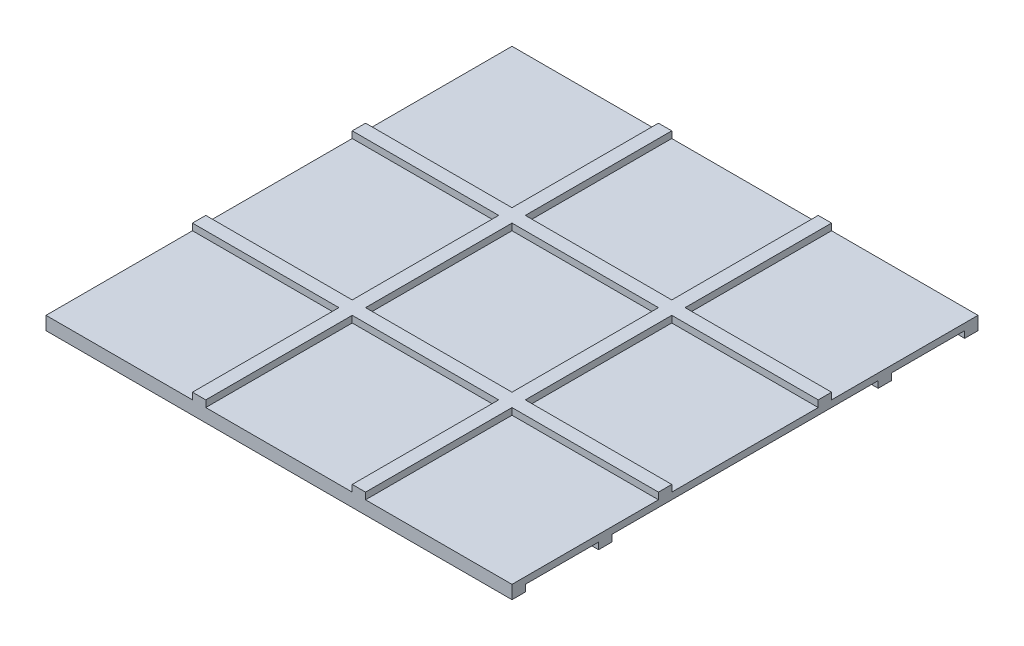
from build123d import *

# Parameters (mm, degrees)
CROQUIS1_W              = 350
CROQUIS1_H              = 350
SALIENTE_EXTRUIR1_DEPTH = 5
CROQUIS2_W              = 350
CROQUIS2_H              = 10
SALIENTE_EXTRUIR2_DEPTH = 5
CROQUIS3_W              = 110
CROQUIS3_H              = 110
SALIENTE_EXTRUIR3_DEPTH = 5


with BuildPart() as part:
    # Croquis1 → Saliente-Extruir1 (new body)
    with BuildSketch(Plane(origin=(0, 0, 0), x_dir=(1, 0, 0), z_dir=(0, 1, 0))):
        with Locations((175, 175)):
            Rectangle(CROQUIS1_W, CROQUIS1_H)
    extrude(amount=SALIENTE_EXTRUIR1_DEPTH)

    # Croquis2 → Saliente-Extruir2 (add)
    with BuildSketch(Plane.XZ):
        with Locations((175, -5)):
            Rectangle(CROQUIS2_W, CROQUIS2_H)
        with Locations((175, -345)):
            Rectangle(CROQUIS2_W, CROQUIS2_H)
        with Locations((175, -70)):
            Rectangle(CROQUIS2_W, CROQUIS2_H)
        with Locations((175, -280)):
            Rectangle(CROQUIS2_W, CROQUIS2_H)
    extrude(amount=SALIENTE_EXTRUIR2_DEPTH)

    # Croquis3 → Saliente-Extruir3 (add)
    with BuildSketch(Plane(origin=(0, 5, 0), x_dir=(1, 0, 0), z_dir=(0, 1, 0))):
        Polygon((110, 350), (120, 350), (120, 240), (230, 240), (230, 350), (240, 350), (240, 240), (350, 240), (350, 230), (240, 230), (240, 120), (350, 120), (350, 110), (240, 110), (240, 0), (230, 0), (230, 110), (120, 110), (120, 0), (110, 0), (110, 110), (0, 110), (0, 120), (110, 120), (110, 230), (0, 230), (0, 240), (110, 240), align=None)
        with Locations((175, 175)):
            Rectangle(CROQUIS3_W, CROQUIS3_H, mode=Mode.SUBTRACT)
    extrude(amount=SALIENTE_EXTRUIR3_DEPTH)


solid = part.part
